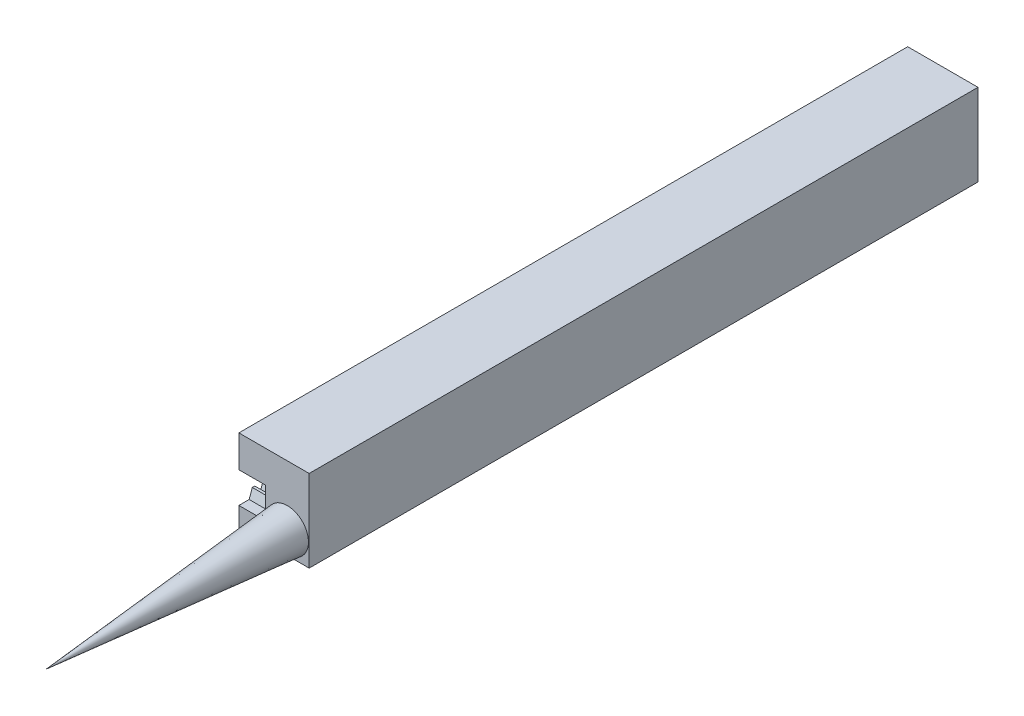
from build123d import *

# Parameters (mm, degrees)
SKIZZE1_W                       = 66
SKIZZE1_H                       = 77
AUFSATZ_LINEAR_AUSTRAGEN1_DEPTH = 628
SKIZZE2_W                       = 25
SKIZZE2_H                       = 29
SCHNITT_LINEAR_AUSTRAGEN1_DEPTH = 628
AUFSATZ_LINEAR_AUSTRAGEN3_DEPTH = 25
SKIZZE4_R                       = 19.825086511
AUFSATZ_LINEAR_AUSTRAGEN4_DEPTH = 228
AUFSATZ_LINEAR_AUSTRAGEN4_TAPER = 5


with BuildPart() as part:
    # Skizze1 → Aufsatz-Linear austragen1 (new body)
    with BuildSketch(Plane.XY):
        Rectangle(SKIZZE1_W, SKIZZE1_H)
    extrude(amount=AUFSATZ_LINEAR_AUSTRAGEN1_DEPTH)

    # Skizze2 → Schnitt-Linear austragen1 (cut)
    with BuildSketch(Plane(origin=(0, 0, 0), x_dir=(-1, 0, 0), z_dir=(0, 0, -1))):
        with Locations((20.5, -6)):
            Rectangle(SKIZZE2_W, SKIZZE2_H)
    extrude(amount=-SCHNITT_LINEAR_AUSTRAGEN1_DEPTH, mode=Mode.SUBTRACT)

    # Skizze3 → Aufsatz-Linear austragen3 (add)
    with BuildSketch(Plane.ZY.offset(8)):
        Polygon((18.366966389, -20.5), (10, -20.5), (13.005947615, -12.215094727), (15.361018774, -12.215094727), align=None)
        Polygon((0, -20.5), (3.005947615, -12.215094727), (5.361018774, -12.215094727), (8.366966389, -20.5), align=None)
        Polygon((28.366966389, -20.5), (20, -20.5), (23.005947615, -12.215094727), (25.361018774, -12.215094727), align=None)
        Polygon((38.366966389, -20.5), (30, -20.5), (33.005947615, -12.215094727), (35.361018774, -12.215094727), align=None)
        Polygon((48.366966389, -20.5), (40, -20.5), (43.005947615, -12.215094727), (45.361018774, -12.215094727), align=None)
        Polygon((58.366966389, -20.5), (50, -20.5), (53.005947615, -12.215094727), (55.361018774, -12.215094727), align=None)
        Polygon((68.366966389, -20.5), (60, -20.5), (63.005947615, -12.215094727), (65.361018774, -12.215094727), align=None)
        Polygon((78.366966389, -20.5), (70, -20.5), (73.005947615, -12.215094727), (75.361018774, -12.215094727), align=None)
        Polygon((88.366966389, -20.5), (80, -20.5), (83.005947615, -12.215094727), (85.361018774, -12.215094727), align=None)
        Polygon((98.366966389, -20.5), (90, -20.5), (93.005947615, -12.215094727), (95.361018774, -12.215094727), align=None)
        Polygon((108.366966389, -20.5), (100, -20.5), (103.005947615, -12.215094727), (105.361018774, -12.215094727), align=None)
        Polygon((118.366966389, -20.5), (110, -20.5), (113.005947615, -12.215094727), (115.361018774, -12.215094727), align=None)
        Polygon((128.366966389, -20.5), (120, -20.5), (123.005947615, -12.215094727), (125.361018774, -12.215094727), align=None)
        Polygon((138.366966389, -20.5), (130, -20.5), (133.005947615, -12.215094727), (135.361018774, -12.215094727), align=None)
        Polygon((148.366966389, -20.5), (140, -20.5), (143.005947615, -12.215094727), (145.361018774, -12.215094727), align=None)
        Polygon((158.366966389, -20.5), (150, -20.5), (153.005947615, -12.215094727), (155.361018774, -12.215094727), align=None)
        Polygon((168.366966389, -20.5), (160, -20.5), (163.005947615, -12.215094727), (165.361018774, -12.215094727), align=None)
        Polygon((178.366966389, -20.5), (170, -20.5), (173.005947615, -12.215094727), (175.361018774, -12.215094727), align=None)
        Polygon((188.366966389, -20.5), (180, -20.5), (183.005947615, -12.215094727), (185.361018774, -12.215094727), align=None)
        Polygon((198.366966389, -20.5), (190, -20.5), (193.005947615, -12.215094727), (195.361018774, -12.215094727), align=None)
        Polygon((208.366966389, -20.5), (200, -20.5), (203.005947615, -12.215094727), (205.361018774, -12.215094727), align=None)
        Polygon((218.366966389, -20.5), (210, -20.5), (213.005947615, -12.215094727), (215.361018774, -12.215094727), align=None)
        Polygon((228.366966389, -20.5), (220, -20.5), (223.005947615, -12.215094727), (225.361018774, -12.215094727), align=None)
        Polygon((238.366966389, -20.5), (230, -20.5), (233.005947615, -12.215094727), (235.361018774, -12.215094727), align=None)
        Polygon((248.366966389, -20.5), (240, -20.5), (243.005947615, -12.215094727), (245.361018774, -12.215094727), align=None)
        Polygon((258.366966389, -20.5), (250, -20.5), (253.005947615, -12.215094727), (255.361018774, -12.215094727), align=None)
        Polygon((268.366966389, -20.5), (260, -20.5), (263.005947615, -12.215094727), (265.361018774, -12.215094727), align=None)
        Polygon((278.366966389, -20.5), (270, -20.5), (273.005947615, -12.215094727), (275.361018774, -12.215094727), align=None)
        Polygon((288.366966389, -20.5), (280, -20.5), (283.005947615, -12.215094727), (285.361018774, -12.215094727), align=None)
        Polygon((298.366966389, -20.5), (290, -20.5), (293.005947615, -12.215094727), (295.361018774, -12.215094727), align=None)
        Polygon((308.366966389, -20.5), (300, -20.5), (303.005947615, -12.215094727), (305.361018774, -12.215094727), align=None)
        Polygon((318.366966389, -20.5), (310, -20.5), (313.005947615, -12.215094727), (315.361018774, -12.215094727), align=None)
        Polygon((328.366966389, -20.5), (320, -20.5), (323.005947615, -12.215094727), (325.361018774, -12.215094727), align=None)
        Polygon((338.366966389, -20.5), (330, -20.5), (333.005947615, -12.215094727), (335.361018774, -12.215094727), align=None)
        Polygon((348.366966389, -20.5), (340, -20.5), (343.005947615, -12.215094727), (345.361018774, -12.215094727), align=None)
        Polygon((358.366966389, -20.5), (350, -20.5), (353.005947615, -12.215094727), (355.361018774, -12.215094727), align=None)
        Polygon((368.366966389, -20.5), (360, -20.5), (363.005947615, -12.215094727), (365.361018774, -12.215094727), align=None)
        Polygon((378.366966389, -20.5), (370, -20.5), (373.005947615, -12.215094727), (375.361018774, -12.215094727), align=None)
        Polygon((388.366966389, -20.5), (380, -20.5), (383.005947615, -12.215094727), (385.361018774, -12.215094727), align=None)
        Polygon((398.366966389, -20.5), (390, -20.5), (393.005947615, -12.215094727), (395.361018774, -12.215094727), align=None)
        Polygon((408.366966389, -20.5), (400, -20.5), (403.005947615, -12.215094727), (405.361018774, -12.215094727), align=None)
        Polygon((418.366966389, -20.5), (410, -20.5), (413.005947615, -12.215094727), (415.361018774, -12.215094727), align=None)
        Polygon((428.366966389, -20.5), (420, -20.5), (423.005947615, -12.215094727), (425.361018774, -12.215094727), align=None)
        Polygon((438.366966389, -20.5), (430, -20.5), (433.005947615, -12.215094727), (435.361018774, -12.215094727), align=None)
        Polygon((448.366966389, -20.5), (440, -20.5), (443.005947615, -12.215094727), (445.361018774, -12.215094727), align=None)
        Polygon((458.366966389, -20.5), (450, -20.5), (453.005947615, -12.215094727), (455.361018774, -12.215094727), align=None)
        Polygon((468.366966389, -20.5), (460, -20.5), (463.005947615, -12.215094727), (465.361018774, -12.215094727), align=None)
        Polygon((478.366966389, -20.5), (470, -20.5), (473.005947615, -12.215094727), (475.361018774, -12.215094727), align=None)
        Polygon((488.366966389, -20.5), (480, -20.5), (483.005947615, -12.215094727), (485.361018774, -12.215094727), align=None)
        Polygon((498.366966389, -20.5), (490, -20.5), (493.005947615, -12.215094727), (495.361018774, -12.215094727), align=None)
        Polygon((508.366966389, -20.5), (500, -20.5), (503.005947615, -12.215094727), (505.361018774, -12.215094727), align=None)
        Polygon((518.366966389, -20.5), (510, -20.5), (513.005947615, -12.215094727), (515.361018774, -12.215094727), align=None)
        Polygon((528.366966389, -20.5), (520, -20.5), (523.005947615, -12.215094727), (525.361018774, -12.215094727), align=None)
        Polygon((538.366966389, -20.5), (530, -20.5), (533.005947615, -12.215094727), (535.361018774, -12.215094727), align=None)
        Polygon((548.366966389, -20.5), (540, -20.5), (543.005947615, -12.215094727), (545.361018774, -12.215094727), align=None)
        Polygon((558.366966389, -20.5), (550, -20.5), (553.005947615, -12.215094727), (555.361018774, -12.215094727), align=None)
        Polygon((568.366966389, -20.5), (560, -20.5), (563.005947615, -12.215094727), (565.361018774, -12.215094727), align=None)
        Polygon((578.366966389, -20.5), (570, -20.5), (573.005947615, -12.215094727), (575.361018774, -12.215094727), align=None)
        Polygon((588.366966389, -20.5), (580, -20.5), (583.005947615, -12.215094727), (585.361018774, -12.215094727), align=None)
        Polygon((598.366966389, -20.5), (590, -20.5), (593.005947615, -12.215094727), (595.361018774, -12.215094727), align=None)
        Polygon((608.366966389, -20.5), (600, -20.5), (603.005947615, -12.215094727), (605.361018774, -12.215094727), align=None)
        Polygon((618.366966389, -20.5), (610, -20.5), (613.005947615, -12.215094727), (615.361018774, -12.215094727), align=None)
    extrude(amount=AUFSATZ_LINEAR_AUSTRAGEN3_DEPTH)

    # Skizze4 → Aufsatz-Linear austragen4 (add)
    with BuildSketch(Plane.XY.offset(628)):
        with Locations((12.518260475, -17.69094943)):
            Circle(SKIZZE4_R)
    extrude(amount=AUFSATZ_LINEAR_AUSTRAGEN4_DEPTH, taper=AUFSATZ_LINEAR_AUSTRAGEN4_TAPER)


solid = part.part
